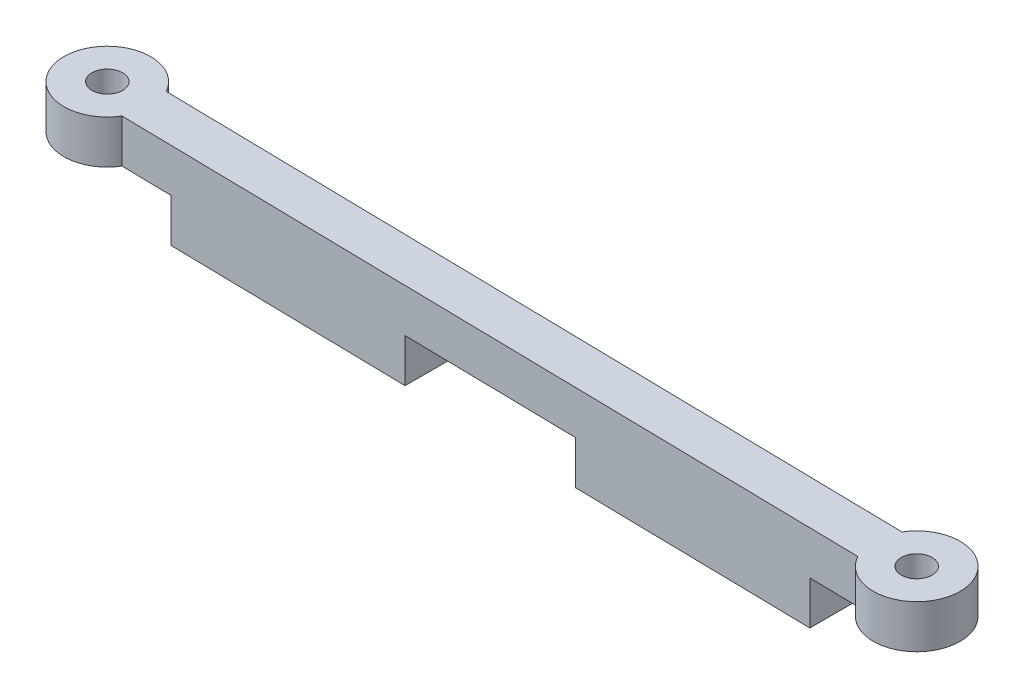
from build123d import *

# Parameters (mm, degrees)
SKETCH2_R           = 2.2479
BOSS_EXTRUDE2_DEPTH = 12.7
SKETCH3_R           = 6.35
SKETCH3_W           = 12.7
SKETCH3_H           = 9.756200869
SKETCH3_H_2         = 9.756200868
CUT_EXTRUDE1_DEPTH  = 6.35
CUT_EXTRUDE2_DEPTH  = 6.35


with BuildPart() as part:
    # Sketch2 → Boss-Extrude2 (new body)
    with BuildSketch(Plane(origin=(0, 0, 0), x_dir=(1, 0, 0), z_dir=(0, 1, 0))):
        with BuildLine():
            ThreePointArc((5.556434937, 3.073846253), (-6.34894802, 0.115581283), (5.440872802, -3.274049962))
            Line((5.440872802, -3.274049962), (115.093565063, -5.270254505))
            ThreePointArc((115.093565063, -5.270254505), (126.99894802, -2.311989535), (115.209127198, 1.07764171))
            Line((115.209127198, 1.07764171), (5.556434937, 3.073846253))
        make_face()
        with Locations(Location((120.65, -2.196408252, 0), (0, 0, 270))):
            Circle(SKETCH2_R, mode=Mode.SUBTRACT)
        with Locations(Location((0, 0, 0), (0, 0, 270))):
            Circle(SKETCH2_R, mode=Mode.SUBTRACT)
    extrude(amount=BOSS_EXTRUDE2_DEPTH)

    # Sketch3 → Cut-Extrude1 (cut)
    with BuildSketch(Plane.XZ):
        Circle(SKETCH3_R)
        with Locations((120.65, 2.196408252)):
            Circle(SKETCH3_R)
        with Locations((6.35, -1.471899566)):
            Rectangle(SKETCH3_W, SKETCH3_H)
        with Locations((114.3, 3.668307818)):
            Rectangle(SKETCH3_W, SKETCH3_H_2)
    extrude(amount=-CUT_EXTRUDE1_DEPTH, mode=Mode.SUBTRACT)

    # Sketch4 → Cut-Extrude2 (cut)
    with BuildSketch(Plane.XZ):
        Polygon((47.625, 4.042003257), (47.625, -2.307996743), (73.025, -1.845595005), (73.025, 4.504404995), align=None)
    extrude(amount=-CUT_EXTRUDE2_DEPTH, mode=Mode.SUBTRACT)


solid = part.part
